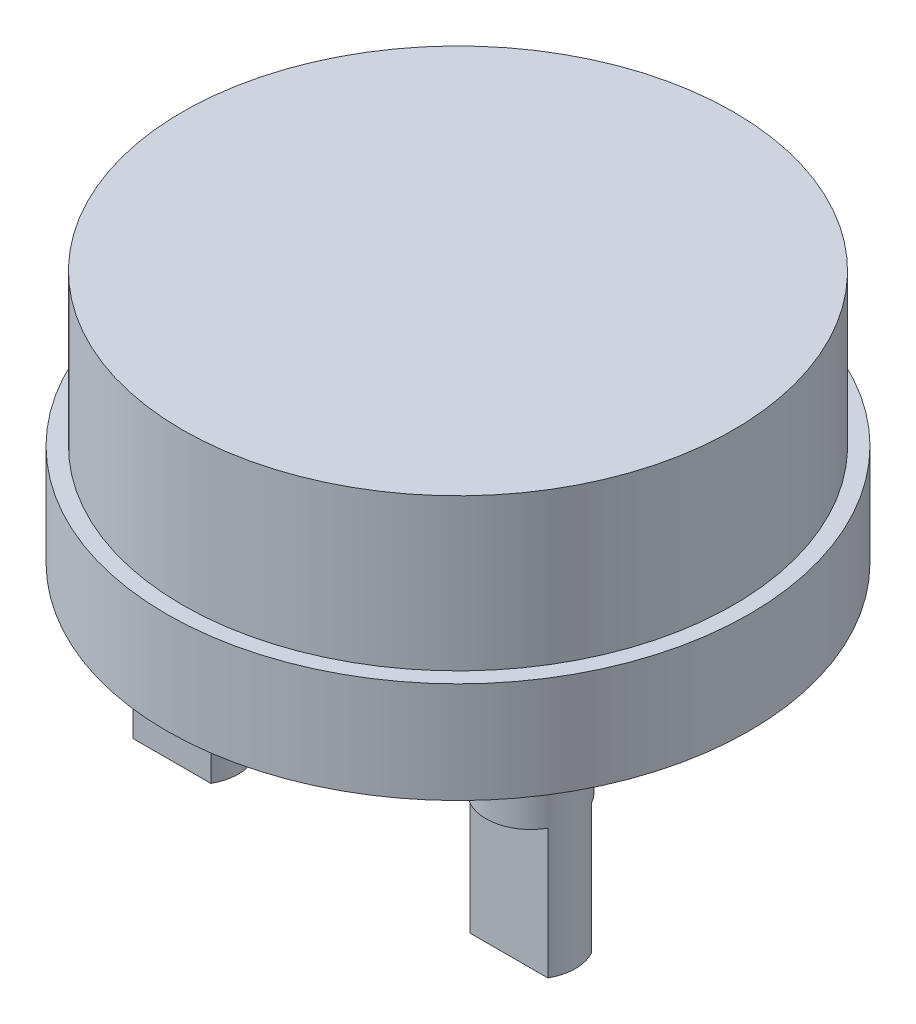
from build123d import *
from build123d.topology import SkipClean

# Parameters (mm, degrees)
SKETCH_1_R      = 16.35
EXTRUDE_1_DEPTH = 9
SKETCH_2_R      = 17.29
EXTRUDE_2_DEPTH = 6
SKETCH_3_R      = 5.5
SKETCH_3_R_2    = 1.9
SKETCH_3_R_3    = 2.65
EXTRUDE_3_DEPTH = 4
EXTRUDE_4_DEPTH = 7.7


with BuildPart() as part:
    # 草图1 → 凸台-拉伸1 (new body)
    with BuildSketch(Plane(origin=(0, 0, 0), x_dir=(1, 0, 0), z_dir=(0, 1, 0))):
        with Locations(Location((0, 0, 0), (0, 0, 270))):
            Circle(SKETCH_1_R)
    extrude(amount=EXTRUDE_1_DEPTH)

    # 草图2 → 凸台-拉伸2 (add)
    with BuildSketch(Plane.XZ):
        with Locations(Location((0, 0, 0), (0, 0, 270))):
            Circle(SKETCH_2_R)
    extrude(amount=EXTRUDE_2_DEPTH)

    # 草图3 → 凸台-拉伸3 (add)
    with BuildSketch(Plane.XZ.offset(6)):
        with Locations(Location((0, 0, 0), (0, 0, 270))):
            Circle(SKETCH_3_R)
        with Locations(Location((-6.6, -9.56, 0), (0, 0, 270))):
            Circle(SKETCH_3_R_2)
        with Locations(Location((-10, 5.68, 0), (0, 0, 270))):
            Circle(SKETCH_3_R_3)
        with Locations(Location((6.6, -9.56, 0), (0, 0, 90))):
            Circle(SKETCH_3_R_2)
        with Locations(Location((10, 5.68, 0), (0, 0, 90))):
            Circle(SKETCH_3_R_3)
    extrude(amount=EXTRUDE_3_DEPTH)

    # 草图4 → 凸台-拉伸4 (add)
    with SkipClean():  # the faces are left unmerged after this step: merging them gives an invalid solid
        with BuildSketch(Plane.XZ.offset(10)):
            with BuildLine():
                Line((-12.309220648, 6.98), (-7.690779352, 6.98))
                ThreePointArc((-7.690779352, 6.98), (-7.35, 5.68), (-7.690779352, 4.38))
                Line((-7.690779352, 4.38), (-12.309220648, 4.38))
                ThreePointArc((-12.309220648, 4.38), (-12.65, 5.68), (-12.309220648, 6.98))
            make_face()
            with BuildLine():
                Line((12.309220648, 6.98), (7.690779352, 6.98))
                ThreePointArc((7.690779352, 6.98), (7.35, 5.68), (7.690779352, 4.38))
                Line((7.690779352, 4.38), (12.309220648, 4.38))
                ThreePointArc((12.309220648, 4.38), (12.65, 5.68), (12.309220648, 6.98))
            make_face()
        extrude(amount=EXTRUDE_4_DEPTH)


solid = part.part
